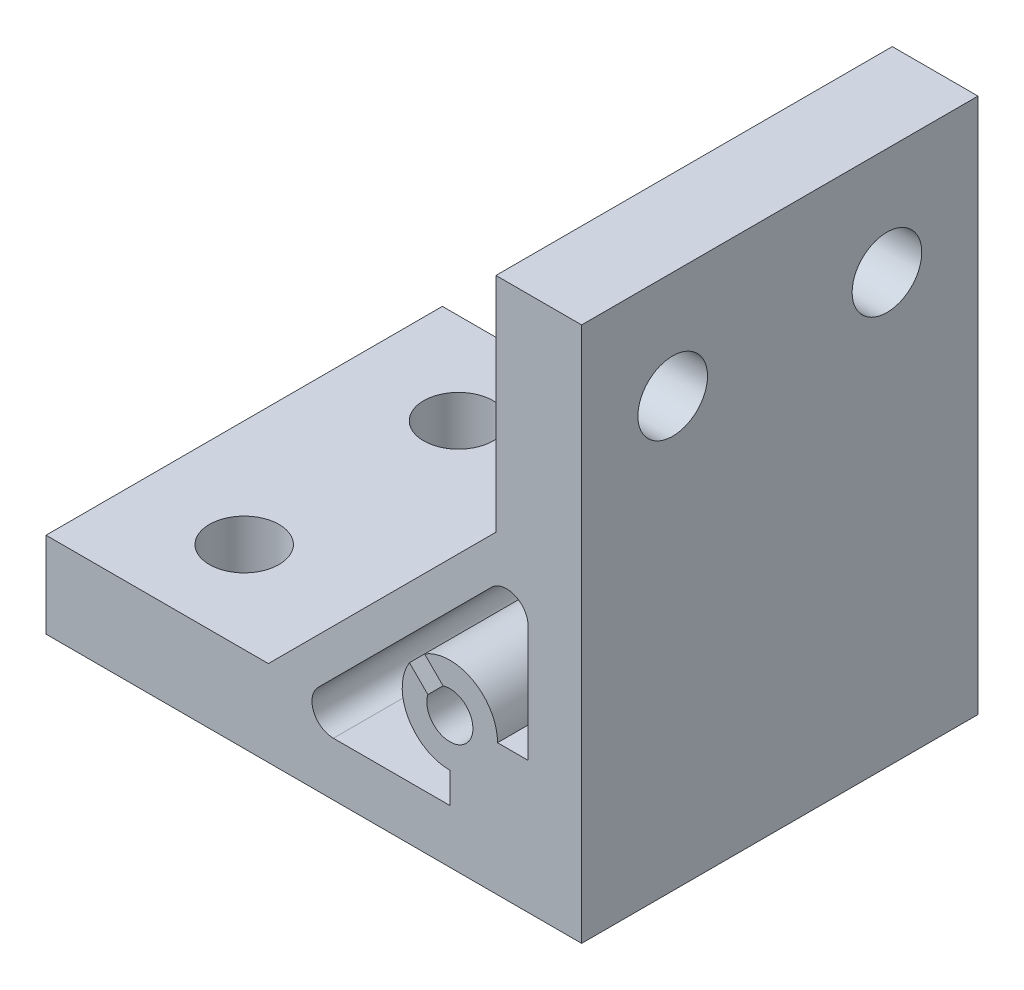
from build123d import *

# Parameters (mm, degrees)
EXTRUDE_1_DEPTH     = 18.5
SKETCH_3_R          = 3.25
CUT_EXTRUDE_1_DEPTH = 68.869359802


with BuildPart() as part:
    # 草图1 → 凸台-拉伸1 (new, symmetric)
    with BuildSketch(Plane.XY):
        Polygon((0, 0), (50, 0), (50, 50), (42, 50), (42, 29.242640687), (20.757359313, 8), (0, 8), align=None)
        with BuildLine():
            Line((37.061279898, 14.352933665), (35.340960992, 16.07325257))
            ThreePointArc((35.340960992, 16.07325257), (39.856939547, 16.192314452), (42.15, 12.3))
            Line((42.15, 12.3), (45, 12.3))
            Line((45, 12.3), (45, 23.171572875))
            ThreePointArc((45, 23.171572875), (43.765366865, 25.01933194), (41.585786438, 24.585786438))
            Line((41.585786438, 24.585786438), (25.414213562, 8.414213562))
            ThreePointArc((25.414213562, 8.414213562), (24.98066806, 6.234633135), (26.828427125, 5))
            Line((26.828427125, 5), (37.7, 5))
            Line((37.7, 5), (37.7, 7.85))
            ThreePointArc((37.7, 7.85), (33.807685548, 10.143060453), (33.92674743, 14.659039008))
            Line((33.92674743, 14.659039008), (35.647066335, 12.938720102))
            ThreePointArc((35.647066335, 12.938720102), (39.22027958, 10.77972042), (37.061279898, 14.352933665))
        make_face(mode=Mode.SUBTRACT)
    extrude(amount=EXTRUDE_1_DEPTH, both=True)

    # 草图3 → 切除-拉伸1 (cut, through all)
    with BuildSketch(Plane(origin=(0, 8, 0), x_dir=(1, 0, 0), z_dir=(0, 1, 0))):
        with Locations(Location((10, 10, 0), (0, 0, 270))):
            Circle(SKETCH_3_R)
        with Locations(Location((10, -10, 0), (0, 0, 90))):
            Circle(SKETCH_3_R)
    cut_extrude_1 = extrude(amount=-CUT_EXTRUDE_1_DEPTH, mode=Mode.SUBTRACT)

    # 镜向1: 切除-拉伸1 across plane
    add(cut_extrude_1.mirror(Plane(origin=(25, 25, 0), x_dir=(0, 0, 1), z_dir=(-0.7071067811865486, -0.7071067811865465, 0))), mode=Mode.SUBTRACT)


solid = part.part
